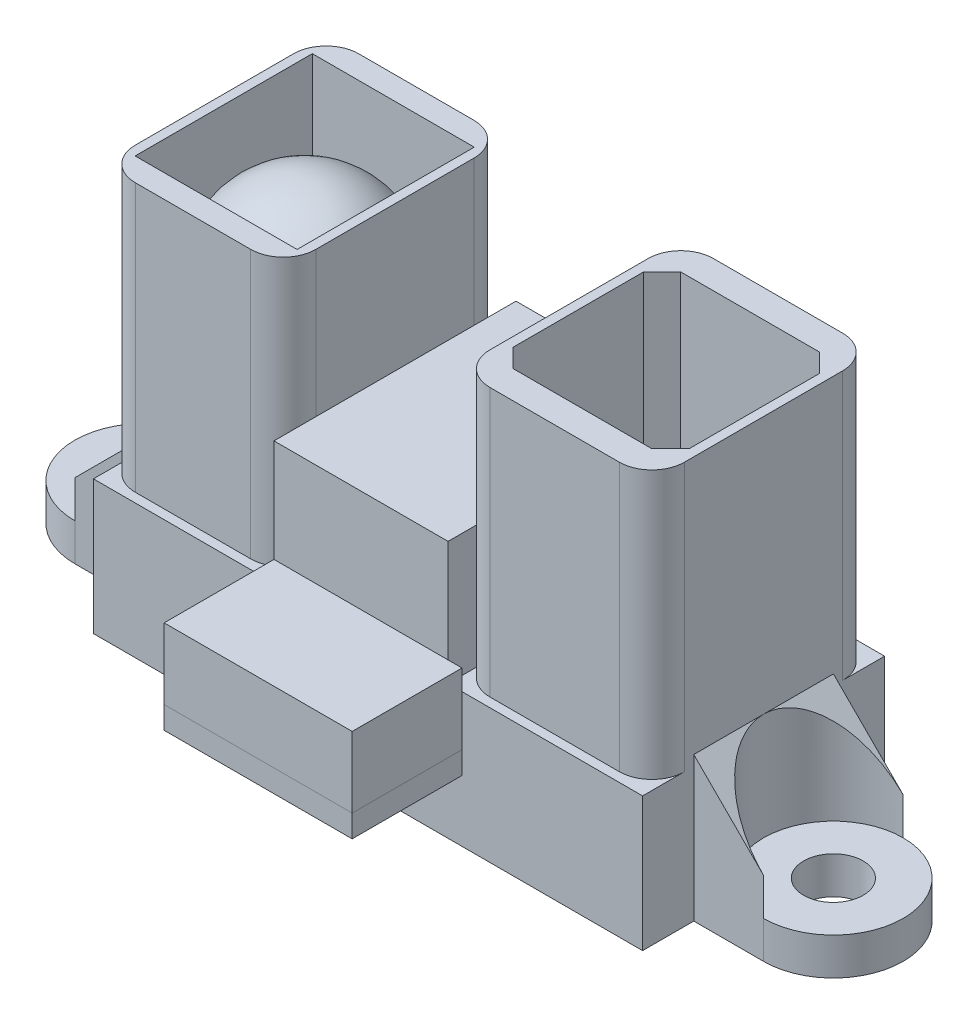
from build123d import *

# Parameters (mm, degrees)
SKETCH_1_W          = 29.5
SKETCH_1_H          = 2.75
SKETCH_1_R          = 1.6
SKETCH_1_H_2        = 7.5
EXTRUDE_1_DEPTH     = 21.6
SKETCH_2_W          = 10.1
SKETCH_2_H          = 7.784294183
CUT_EXTRUDE_1_DEPTH = 21.6
SKETCH_13_R         = 3.75
CUT_EXTRUDE_7_DEPTH = 31.355765515
CUT_EXTRUDE_2_DEPTH = 28.288688133
SKETCH_6_W          = 10.45
SKETCH_6_H          = 13
EXTRUDE_2_DEPTH     = 7.784294183
CUT_EXTRUDE_START   = -14.4
CUT_EXTRUDE_3_DEPTH = 14.4
CUT_EXTRUDE_4_DEPTH = 6
SKETCH_8_W          = 8.7
SKETCH_8_H          = 9.517068374
CUT_EXTRUDE_5_DEPTH = 5
CUT_EXTRUDE_6_DEPTH = 15
SKETCH_11_W         = 10.1
SKETCH_11_H         = 1.2
EXTRUDE_3_DEPTH     = 5.9
SKETCH_12_W         = 10.1
SKETCH_12_H         = 3.8
EXTRUDE_4_DEPTH     = 5.9


with BuildPart() as part:
    # 草图1 → 凸台-拉伸1 (new body)
    # profile 1 of 5: a face of its own
    with BuildSketch(Plane(origin=(0, 0, 0), x_dir=(1, 0, 0), z_dir=(0, 1, 0))):
        with Locations((0, -5.125)):
            Rectangle(SKETCH_1_W, SKETCH_1_H)
    # profile 2 of 5: a face of its own
    with BuildSketch(Plane(origin=(0, 0, 0), x_dir=(1, 0, 0), z_dir=(0, 1, 0))):
        with BuildLine():
            Line((18.5, 3.75), (14.75, 3.75))
            Line((14.75, 3.75), (14.75, -3.75))
            Line((14.75, -3.75), (18.5, -3.75))
            ThreePointArc((18.5, -3.75), (22.25, 0), (18.5, 3.75))
        make_face()
        with Locations(Location((18.5, 0, 0), (0, 0, 90))):
            Circle(SKETCH_1_R, mode=Mode.SUBTRACT)
    # profile 3 of 5: a face of its own
    with BuildSketch(Plane(origin=(0, 0, 0), x_dir=(1, 0, 0), z_dir=(0, 1, 0))):
        Rectangle(SKETCH_1_W, SKETCH_1_H_2)
    # profile 4 of 5: a face of its own
    with BuildSketch(Plane(origin=(0, 0, 0), x_dir=(1, 0, 0), z_dir=(0, 1, 0))):
        with Locations((0, 5.125)):
            Rectangle(SKETCH_1_W, SKETCH_1_H)
    # profile 5 of 5: a face of its own
    with BuildSketch(Plane(origin=(0, 0, 0), x_dir=(1, 0, 0), z_dir=(0, 1, 0))):
        with BuildLine():
            Line((-14.75, -3.75), (-14.75, 3.75))
            Line((-14.75, 3.75), (-18.5, 3.75))
            ThreePointArc((-18.5, 3.75), (-22.25, 0), (-18.5, -3.75))
            Line((-18.5, -3.75), (-14.75, -3.75))
        make_face()
        with Locations(Location((-18.5, 0, 0), (0, 0, 90))):
            Circle(SKETCH_1_R, mode=Mode.SUBTRACT)
    extrude(amount=EXTRUDE_1_DEPTH)

    # 草图2 → 切除-拉伸1 (cut)
    with BuildSketch(Plane.XY.offset(6.5)):
        Polygon((-22.25, 2), (-18.5, 2), (-18.5, 4), (-14.75, 7.75), (-14.75, 21.6), (-22.25, 21.6), align=None)
        Polygon((18.5, 4), (18.5, 2), (22.25, 2), (22.25, 21.6), (14.75, 21.6), (14.75, 7.75), align=None)
        with Locations((0, 17.707852909)):
            Rectangle(SKETCH_2_W, SKETCH_2_H)
    extrude(amount=-CUT_EXTRUDE_1_DEPTH, mode=Mode.SUBTRACT)

    # 草图13 → 切除-拉伸7 (cut, through all)
    with BuildSketch(Plane(origin=(0, 2, 0), x_dir=(1, 0, 0), z_dir=(0, 1, 0))):
        with Locations((-18.5, 0)):
            Circle(SKETCH_13_R)
        with Locations((18.5, 0)):
            Circle(SKETCH_13_R)
    extrude(amount=CUT_EXTRUDE_7_DEPTH, mode=Mode.SUBTRACT)

    # 草图4 → 切除-拉伸2 (cut, through all)
    with BuildSketch(Plane(origin=(0, 7.2, 0), x_dir=(1, 0, 0), z_dir=(0, 1, 0))):
        with BuildLine():
            ThreePointArc((-13, -6), (-14.237436867, -5.487436867), (-14.75, -4.25))
            Line((-14.75, -4.25), (-14.75, -6.5))
            Line((-14.75, -6.5), (-5.05, -6.5))
            Line((-5.05, -6.5), (-5.05, -4.25))
            ThreePointArc((-5.05, -4.25), (-5.562563133, -5.487436867), (-6.8, -6))
            Line((-6.8, -6), (-13, -6))
        make_face()
        with BuildLine():
            Line((-5.05, 6.5), (-14.75, 6.5))
            Line((-14.75, 6.5), (-14.75, 4.25))
            ThreePointArc((-14.75, 4.25), (-14.237436867, 5.487436867), (-13, 6))
            Line((-13, 6), (-6.8, 6))
            ThreePointArc((-6.8, 6), (-5.562563133, 5.487436867), (-5.05, 4.25))
            Line((-5.05, 4.25), (-5.05, 6.5))
        make_face()
    extrude(amount=CUT_EXTRUDE_2_DEPTH, mode=Mode.SUBTRACT)

    # 草图6 → 凸台-拉伸2 (add)
    with BuildSketch(Plane(origin=(0, 21.6, 0), x_dir=(1, 0, 0), z_dir=(0, 1, 0))):
        with Locations((9.525, 0)):
            Rectangle(SKETCH_6_W, SKETCH_6_H)
    extrude(amount=-EXTRUDE_2_DEPTH)

    # 草图5 → 切除-拉伸3 (cut)
    with BuildSketch(Plane(origin=(0, 21.6, 0), x_dir=(1, 0, 0), z_dir=(0, 1, 0)).offset(CUT_EXTRUDE_START)):
        with BuildLine():
            Line((14.75, -6.5), (14.75, -4.25))
            ThreePointArc((14.75, -4.25), (14.237436867, -5.487436867), (13, -6))
            Line((13, -6), (6.05, -6))
            ThreePointArc((6.05, -6), (4.812563133, -5.487436867), (4.3, -4.25))
            Line((4.3, -4.25), (4.3, -6.5))
            Line((4.3, -6.5), (14.75, -6.5))
        make_face()
        with BuildLine():
            Line((14.75, 4.25), (14.75, 6.5))
            Line((14.75, 6.5), (4.3, 6.5))
            Line((4.3, 6.5), (4.3, 4.25))
            ThreePointArc((4.3, 4.25), (4.812563133, 5.487436867), (6.05, 6))
            Line((6.05, 6), (13, 6))
            ThreePointArc((13, 6), (14.237436867, 5.487436867), (14.75, 4.25))
        make_face()
    extrude(amount=CUT_EXTRUDE_3_DEPTH, mode=Mode.SUBTRACT)

    # 草图7 → 切除-拉伸4 (cut)
    with BuildSketch(Plane(origin=(0, 21.6, 0), x_dir=(1, 0, 0), z_dir=(0, 1, 0))):
        with BuildLine():
            ThreePointArc((-5.55, 1.929027633), (-7.305360943, 3.98892163), (-9.9, 4.758534187))
            ThreePointArc((-9.9, 4.758534187), (-12.494639057, 3.98892163), (-14.25, 1.929027633))
            Line((-14.25, 1.929027633), (-14.25, -1.929027633))
            ThreePointArc((-14.25, -1.929027633), (-12.494639057, -3.98892163), (-9.9, -4.758534187))
            ThreePointArc((-9.9, -4.758534187), (-7.305360943, -3.98892163), (-5.55, -1.929027633))
            Line((-5.55, -1.929027633), (-5.55, 1.929027633))
        make_face()
    extrude(amount=-CUT_EXTRUDE_4_DEPTH, mode=Mode.SUBTRACT)

    # 草图8 → 切除-拉伸5 (cut)
    with BuildSketch(Plane(origin=(0, 21.6, 0), x_dir=(1, 0, 0), z_dir=(0, 1, 0))):
        with Locations((-9.9, 0)):
            Rectangle(SKETCH_8_W, SKETCH_8_H)
    extrude(amount=-CUT_EXTRUDE_5_DEPTH, mode=Mode.SUBTRACT)

    # 草图10 → 切除-拉伸6 (cut)
    with BuildSketch(Plane(origin=(0, 21.6, 0), x_dir=(1, 0, 0), z_dir=(0, 1, 0))):
        Polygon((5.8, 4.5), (13.25, 4.5), (14.25, 3.5), (14.25, -3.5), (13.25, -4.5), (5.8, -4.5), (4.8, -3.5), (4.8, 3.5), align=None)
    extrude(amount=-CUT_EXTRUDE_6_DEPTH, mode=Mode.SUBTRACT)

    # 草图11 → 凸台-拉伸3 (add)
    with BuildSketch(Plane.XY.offset(6.5)):
        with Locations((0, 3.9)):
            Rectangle(SKETCH_11_W, SKETCH_11_H)
    extrude(amount=EXTRUDE_3_DEPTH)


with BuildPart() as body_2:
    # 草图9 → 旋转1 (revolve)
    with BuildSketch(Plane.YZ.offset(-9.9), mode=Mode.PRIVATE) as revolve_1_sk:
        with BuildLine():
            Line((15.6, 0), (15.6, 4.758534187))
            ThreePointArc((15.6, 4.758534187), (18.964791792, 3.364791792), (20.358534187, 0))
            Line((20.358534187, 0), (15.6, 0))
        make_face()
    revolve(revolve_1_sk.sketch.rotate(Axis((-9.9, 15.6, 0), (0, 1, 0)), 180), axis=Axis((-9.9, 15.6, 0), (0, 1, 0)))


with BuildPart() as body_3:
    # 草图12 → 凸台-拉伸4 (new body)
    with BuildSketch(Plane.XY.offset(6.5)):
        with Locations((0, 6.4)):
            Rectangle(SKETCH_12_W, SKETCH_12_H)
    extrude(amount=EXTRUDE_4_DEPTH)


solid = Compound([part.part, body_2.part, body_3.part])
